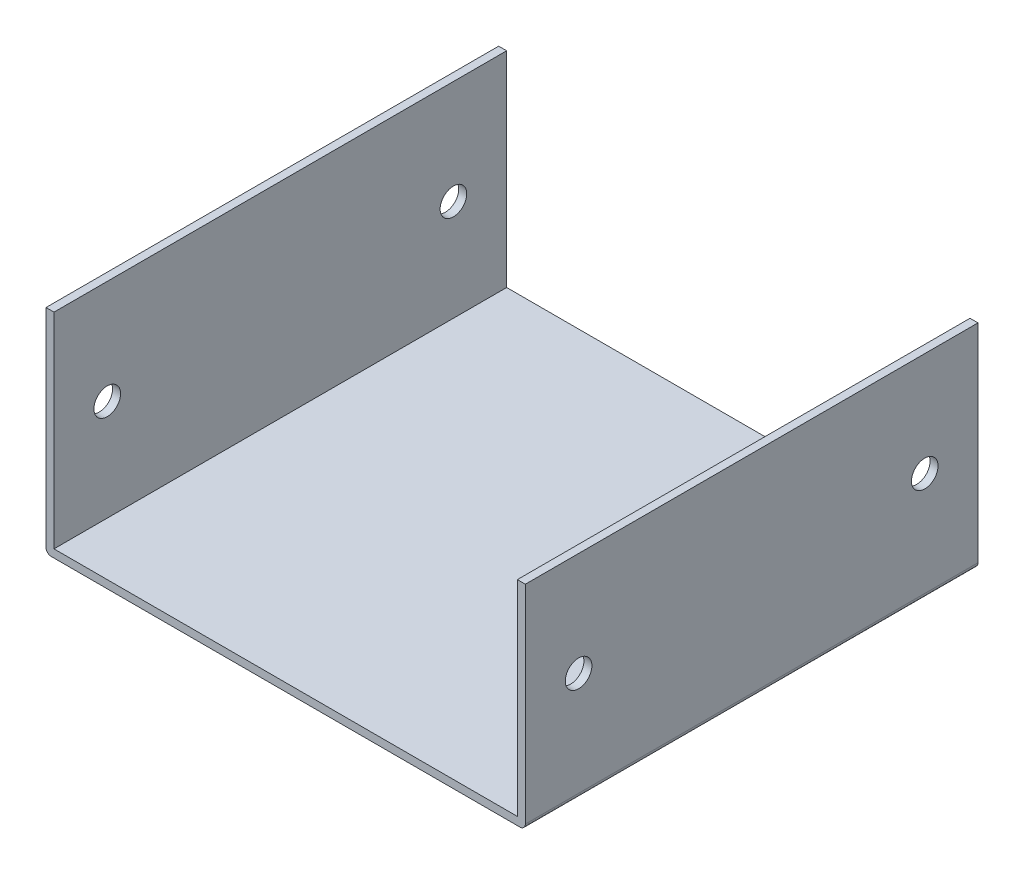
from build123d import *

# Parameters (mm, degrees)
BOSS_EXTRUDE1_DEPTH = 170
FILLET1_R           = 2
FILLET2_R           = 2
SKETCH2_R           = 5
CUT_EXTRUDE2_DEPTH  = 455


with BuildPart() as part:
    # Sketch1 → Boss-Extrude1 (new body)
    with BuildSketch(Plane.XY):
        Polygon((-43.543195893, -41.265832091), (-43.543195893, 35.734167909), (-46.543195893, 35.734167909), (-46.543195893, -44.265832091), (133.456804107, -44.265832091), (133.456804107, 35.734167909), (130.456804107, 35.734167909), (130.456804107, -41.265832091), align=None)
    extrude(amount=BOSS_EXTRUDE1_DEPTH)

    # Fillet1
    fillet1_edges = [part.edges().sort_by_distance(p)[0] for p in [
        (-46.543195893, -44.265832091, 85),
    ]]
    fillet(fillet1_edges, radius=FILLET1_R)

    # Fillet2
    fillet2_edges = [part.edges().sort_by_distance(p)[0] for p in [
        (133.456804107, -44.265832091, 85),
    ]]
    fillet(fillet2_edges, radius=FILLET2_R)

    # Sketch2 → Cut-Extrude2 (cut)
    with BuildSketch(Plane(origin=(133.456804107, 0, 0), x_dir=(0, 0, -1), z_dir=(1, 0, 0))):
        with Locations((-150, -3.265832091)):
            Circle(SKETCH2_R)
        with Locations((-20, -3.265832091)):
            Circle(SKETCH2_R)
    extrude(amount=-CUT_EXTRUDE2_DEPTH, mode=Mode.SUBTRACT)


solid = part.part
